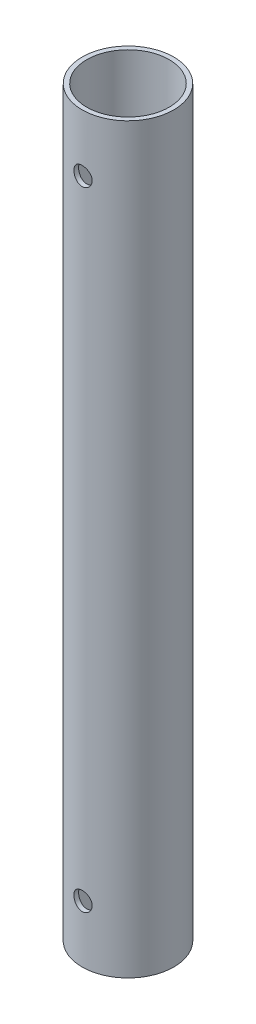
from build123d import *

# Parameters (mm, degrees)
SKETCH1_R           = 10
SKETCH1_R_2         = 9
BOSS_EXTRUDE1_DEPTH = 162
SKETCH3_R           = 2
CUT_EXTRUDE2_DEPTH  = 164.535928774


with BuildPart() as part:
    # Sketch1 → Boss-Extrude1 (new body)
    with BuildSketch(Plane(origin=(0, 0, 0), x_dir=(1, 0, 0), z_dir=(0, 1, 0))):
        with Locations(Location((0, 0, 0), (0, 0, 270))):
            Circle(SKETCH1_R)
        with Locations(Location((0, 0, 0), (0, 0, 270))):
            Circle(SKETCH1_R_2, mode=Mode.SUBTRACT)
    extrude(amount=BOSS_EXTRUDE1_DEPTH)

    # Sketch3 → Cut-Extrude2 (cut, through all)
    with BuildSketch(Plane.XY.offset(10)):
        with Locations((0, 149.5)):
            Circle(SKETCH3_R)
        with Locations((0, 12.5)):
            Circle(SKETCH3_R)
    extrude(amount=-CUT_EXTRUDE2_DEPTH, mode=Mode.SUBTRACT)


solid = part.part
